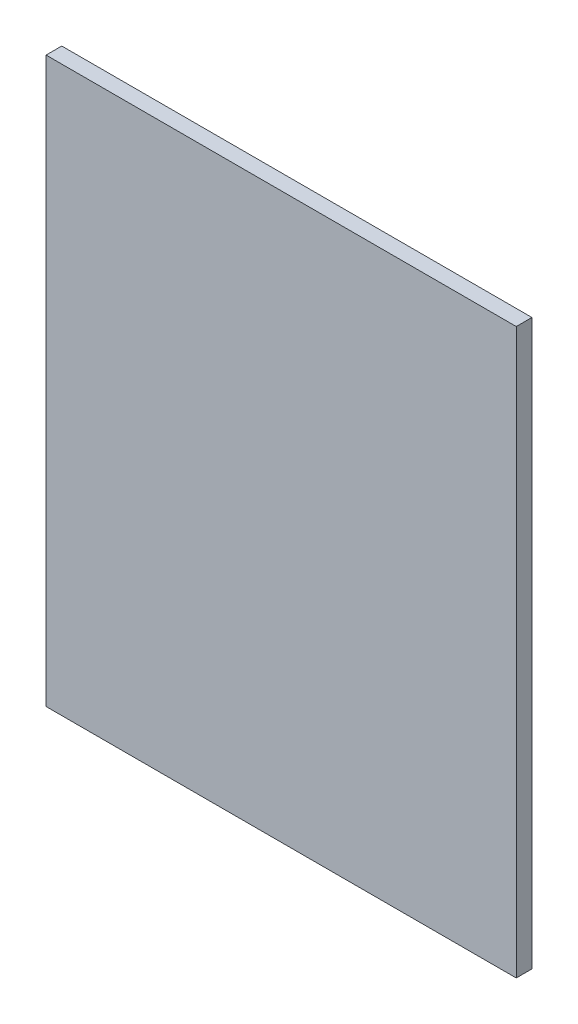
from build123d import *

# Parameters (mm, degrees)
SKETCH1_W           = 300
SKETCH1_H           = 360
BOSS_EXTRUDE1_DEPTH = 10


with BuildPart() as part:
    # Sketch1 → Boss-Extrude1 (new body)
    with BuildSketch(Plane.XY):
        Rectangle(SKETCH1_W, SKETCH1_H)
    extrude(amount=BOSS_EXTRUDE1_DEPTH)


solid = part.part
